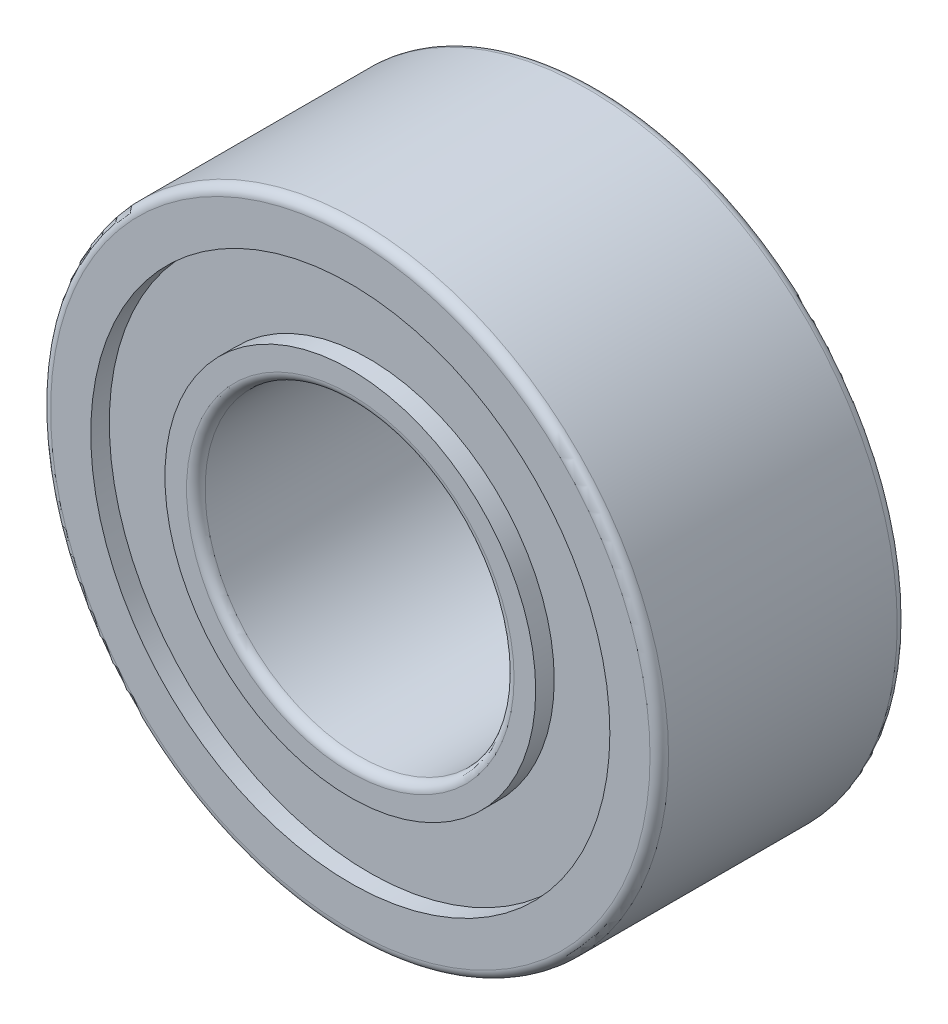
from build123d import *

# Parameters (mm, degrees)
SKETCH1_R           = 5
SKETCH1_R_2         = 2.5
BOSS_EXTRUDE1_DEPTH = 4
SKETCH2_R           = 4.2
SKETCH2_R_2         = 3
CUT_EXTRUDE1_DEPTH  = 0.3
CUT_EXTRUDE2_START  = -3.5
SKETCH2_2_R         = 4.2
SKETCH2_2_R_2       = 3
CUT_EXTRUDE2_DEPTH  = 0.5
FILLET1_R           = 0.15


with BuildPart() as part:
    # Sketch1 → Boss-Extrude1 (new body)
    with BuildSketch(Plane.XY):
        Circle(SKETCH1_R)
        Circle(SKETCH1_R_2, mode=Mode.SUBTRACT)
    extrude(amount=BOSS_EXTRUDE1_DEPTH)

    # Sketch2 → Cut-Extrude1 (cut)
    with BuildSketch(Plane.XY.offset(4)):
        Circle(SKETCH2_R)
        Circle(SKETCH2_R_2, mode=Mode.SUBTRACT)
    extrude(amount=-CUT_EXTRUDE1_DEPTH, mode=Mode.SUBTRACT)

    # Sketch2<2> → Cut-Extrude2 (cut)
    with BuildSketch(Plane.XY.offset(4).offset(CUT_EXTRUDE2_START)):
        Circle(SKETCH2_2_R)
        Circle(SKETCH2_2_R_2, mode=Mode.SUBTRACT)
    extrude(amount=-CUT_EXTRUDE2_DEPTH, mode=Mode.SUBTRACT)

    # Fillet1
    fillet1_edges = [part.edges().sort_by_distance(p)[0] for p in [
        (-5, 0, 0),
        (-5, 0, 4),
        (-2.5, 0, 0),
        (-2.5, 0, 4),
    ]]
    fillet(fillet1_edges, radius=FILLET1_R)


solid = part.part
